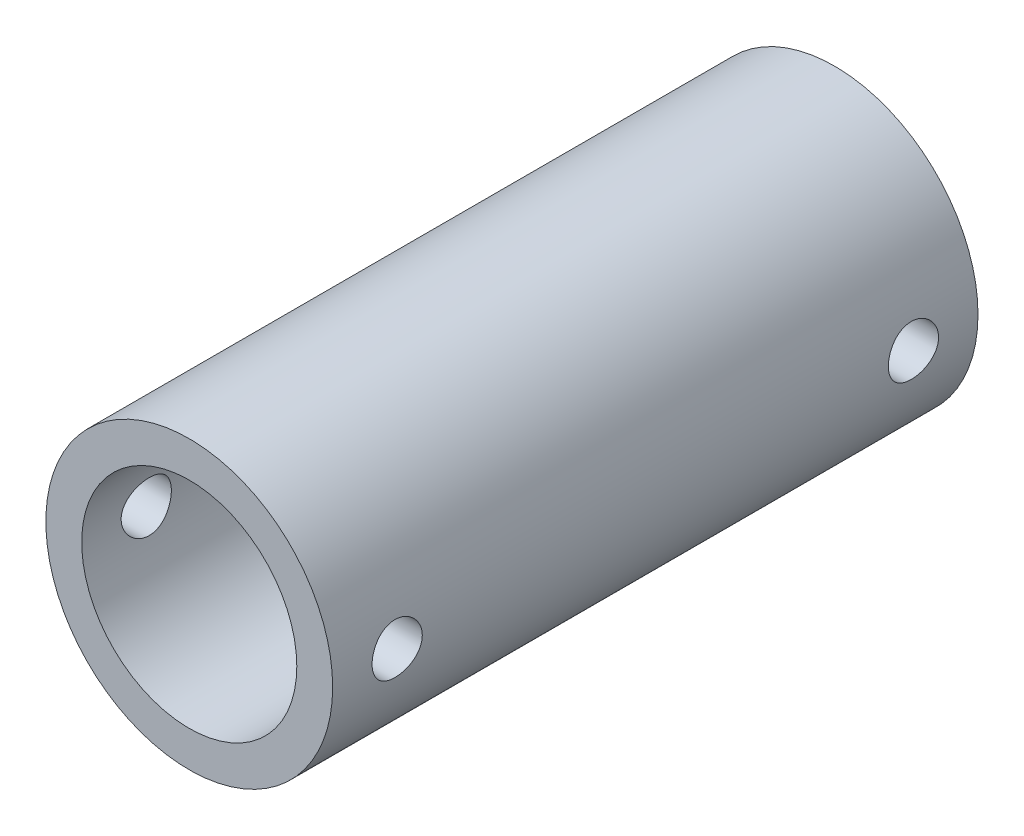
from build123d import *

# Parameters (mm, degrees)
SKETCH1_R               = 40
SKETCH1_R_2             = 30
BOSS_EXTRUDE1_DEPTH     = 90
CUT_EXTRUDE1_DEPTH      = 107.301458127
CUT_EXTRUDE1_DEPTH_BACK = 107.301458127
SKETCH2_R               = 7


with BuildPart() as part:
    # Sketch1 → Boss-Extrude1 (new, symmetric)
    with BuildSketch(Plane.XY):
        with Locations(Location((0, 0, 0), (0, 0, 180))):
            Circle(SKETCH1_R)
        with Locations(Location((0, 0, 0), (0, 0, 180))):
            Circle(SKETCH1_R_2, mode=Mode.SUBTRACT)
    extrude(amount=BOSS_EXTRUDE1_DEPTH, both=True)

    # Sketch2 → Cut-Extrude1 (cut, two sides: drawn at the far end of the back side and taken through both)
    with BuildSketch(Plane(origin=(0, 0, 0), x_dir=(0, 0, -1), z_dir=(1, 0, 0)).offset(-CUT_EXTRUDE1_DEPTH_BACK)):
        with Locations((-72, 0)):
            Circle(SKETCH2_R)
        with Locations((72, 0)):
            Circle(SKETCH2_R)
    extrude(amount=CUT_EXTRUDE1_DEPTH + CUT_EXTRUDE1_DEPTH_BACK, mode=Mode.SUBTRACT)


solid = part.part
